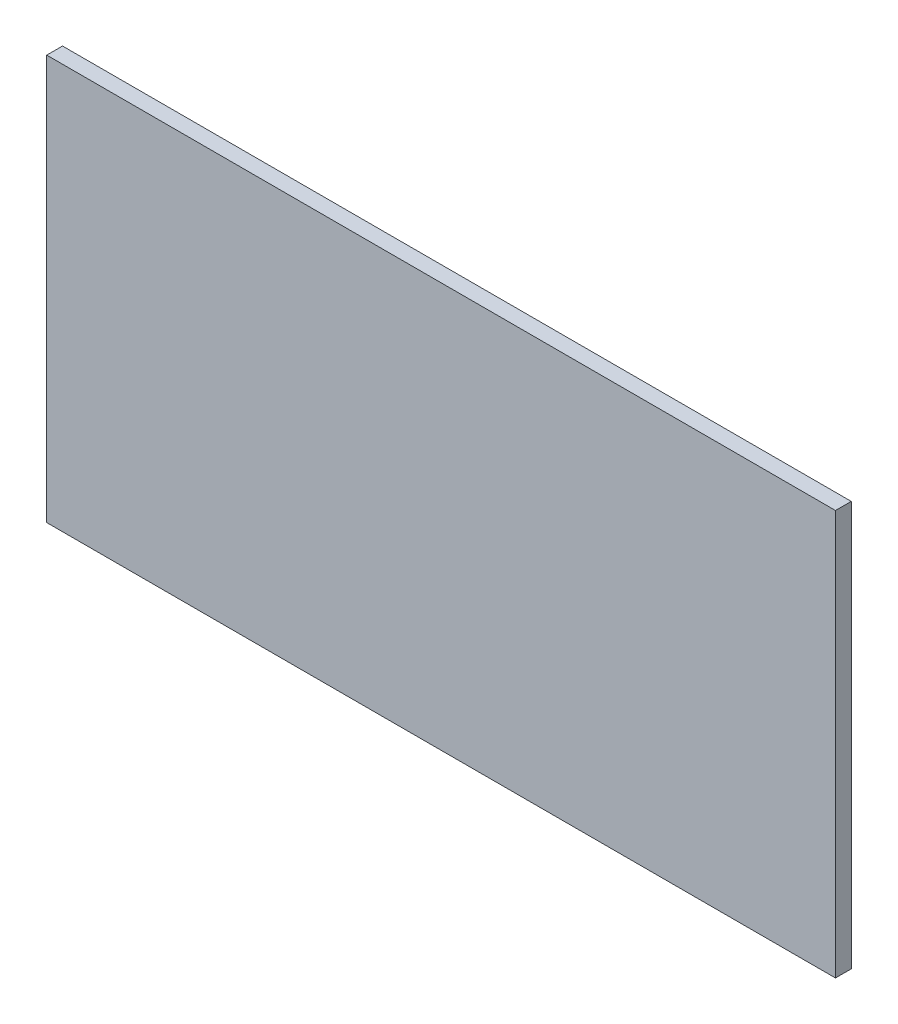
from build123d import *

# Parameters (mm, degrees)
SKETCH_1_W      = 300
SKETCH_1_H      = 154
EXTRUDE_1_DEPTH = 6


with BuildPart() as part:
    # Эскиз1 → Бобышка-Вытянуть1 (new body)
    with BuildSketch(Plane.XY):
        Rectangle(SKETCH_1_W, SKETCH_1_H)
    extrude(amount=EXTRUDE_1_DEPTH)


solid = part.part
